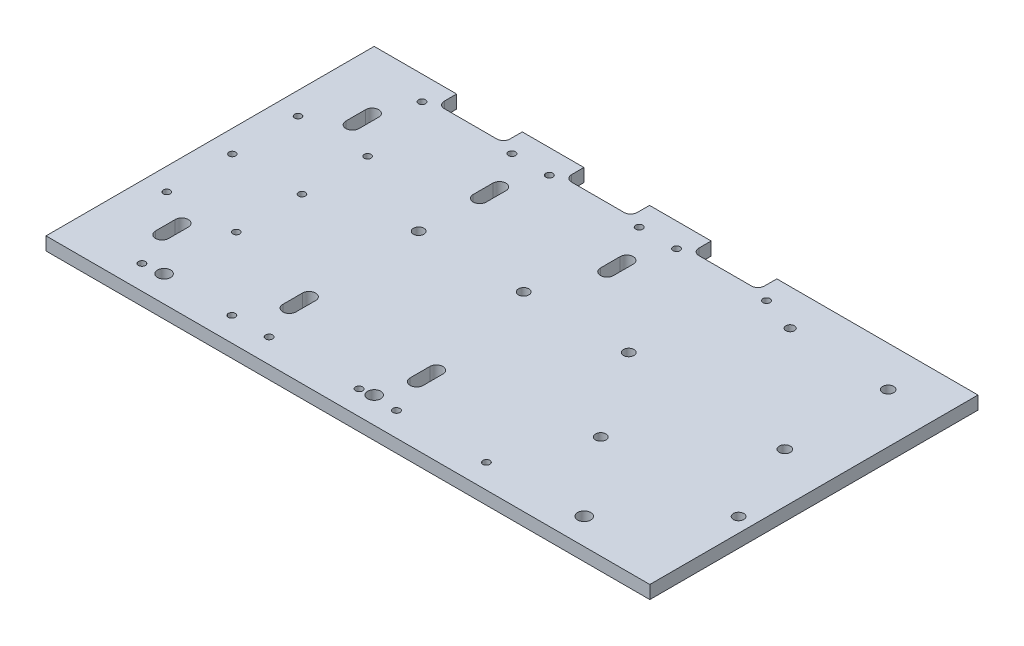
from build123d import *

# Parameters (mm, degrees)
SKETCH1_W           = 292.1
SKETCH1_H           = 158.75
BOSS_EXTRUDE1_DEPTH = 6.35
SKETCH2_R           = 3.175
CUT_EXTRUDE2_DEPTH  = 6.35
SKETCH4_R           = 2.54
SKETCH4_R_2         = 1.651
SKETCH4_R_3         = 2.667
SKETCH4_R_4         = 1.69999914
SKETCH4_R_5         = 2.0955
CUT_EXTRUDE5_DEPTH  = 333.512097524


with BuildPart() as part:
    # Sketch1 → Boss-Extrude1 (new body)
    with BuildSketch(Plane(origin=(0, 0, 0), x_dir=(1, 0, 0), z_dir=(0, 1, 0))):
        with Locations((146.05, 79.375)):
            Rectangle(SKETCH1_W, SKETCH1_H)
    extrude(amount=BOSS_EXTRUDE1_DEPTH)

    # Sketch2 → Cut-Extrude2 (cut)
    with BuildSketch(Plane(origin=(0, 6.35, 0), x_dir=(1, 0, 0), z_dir=(0, 1, 0))):
        with Locations(Location((146.05, 12.7, 0), (0, 0, 270))):
            Circle(SKETCH2_R)
        with Locations(Location((247.65, 12.7, 0), (0, 0, 270))):
            Circle(SKETCH2_R)
        with Locations(Location((44.45, 12.7, 0), (0, 0, 270))):
            Circle(SKETCH2_R)
    extrude(amount=-CUT_EXTRUDE2_DEPTH, mode=Mode.SUBTRACT)

    # Sketch4 → Cut-Extrude5 (cut, through all)
    with BuildSketch(Plane(origin=(0, 6.35, 0), x_dir=(1, 0, 0), z_dir=(0, 1, 0))):
        with Locations(Location((88.2015, 92.075, 0), (0, 0, 270))):
            Circle(SKETCH4_R)
        with Locations(Location((44.45, 111.125, 0), (0, 0, 270))):
            Circle(SKETCH4_R_2)
        with Locations(Location((44.45, 79.375, 0), (0, 0, 270))):
            Circle(SKETCH4_R_2)
        with Locations(Location((44.45, 47.625, 0), (0, 0, 270))):
            Circle(SKETCH4_R_2)
        with Locations(Location((10.795, 111.125, 0), (0, 0, 270))):
            Circle(SKETCH4_R_2)
        with Locations(Location((10.795, 79.375, 0), (0, 0, 270))):
            Circle(SKETCH4_R_2)
        with Locations(Location((10.795, 47.625, 0), (0, 0, 270))):
            Circle(SKETCH4_R_2)
        with Locations(Location((139.0015, 92.075, 0), (0, 0, 270))):
            Circle(SKETCH4_R)
        with Locations(Location((189.8015, 92.075, 0), (0, 0, 270))):
            Circle(SKETCH4_R)
        with Locations(Location((218.4146, 49.9364, 0), (0, 0, 270))):
            Circle(SKETCH4_R)
        with Locations(Location((285.0896, 49.9364, 0), (0, 0, 270))):
            Circle(SKETCH4_R)
        with Locations(Location((268.097, 139.3, 0), (0, 0, 270))):
            Circle(SKETCH4_R_3)
        with Locations(Location((268.097, 89.3, 0), (0, 0, 270))):
            Circle(SKETCH4_R_3)
        with Locations(Location((201.40419192, 147.125001204, 0), (0, 0, 270))):
            Circle(SKETCH4_R_4)
        with Locations(Location((157.90419256, 147.124999631, 0), (0, 0, 270))):
            Circle(SKETCH4_R_4)
        with Locations(Location((139.83529192, 147.125001204, 0), (0, 0, 270))):
            Circle(SKETCH4_R_4)
        with Locations(Location((96.33529256, 147.124999631, 0), (0, 0, 270))):
            Circle(SKETCH4_R_4)
        with Locations(Location((78.26639192, 147.125001204, 0), (0, 0, 270))):
            Circle(SKETCH4_R_4)
        with Locations(Location((34.76639256, 147.124999631, 0), (0, 0, 270))):
            Circle(SKETCH4_R_4)
        with Locations(Location((157.90419746, 11.624998851, 0), (0, 0, 270))):
            Circle(SKETCH4_R_4)
        with Locations(Location((201.40419682, 11.625000424, 0), (0, 0, 270))):
            Circle(SKETCH4_R_4)
        with Locations(Location((139.83529682, 11.625000424, 0), (0, 0, 270))):
            Circle(SKETCH4_R_4)
        with Locations(Location((96.33529746, 11.624998851, 0), (0, 0, 270))):
            Circle(SKETCH4_R_4)
        with Locations(Location((78.26639682, 11.625000424, 0), (0, 0, 270))):
            Circle(SKETCH4_R_4)
        with Locations(Location((34.76639746, 11.624998851, 0), (0, 0, 270))):
            Circle(SKETCH4_R_4)
        with Locations(Location((218.69969445, 141.2875, 0), (0, 0, 270))):
            Circle(SKETCH4_R_5)
        with BuildLine():
            Line((92.33531063, 130.175), (92.33531063, 120.65))
            ThreePointArc((92.33531063, 120.65), (89.16031063, 117.475), (85.98531063, 120.65))
            Line((85.98531063, 120.65), (85.98531063, 130.175))
            ThreePointArc((85.98531063, 130.175), (89.16031063, 133.35), (92.33531063, 130.175))
        make_face()
        with BuildLine():
            Line((30.76641063, 130.175), (30.76641063, 120.65))
            ThreePointArc((30.76641063, 120.65), (27.59141063, 117.475), (24.41641063, 120.65))
            Line((24.41641063, 120.65), (24.41641063, 130.175))
            ThreePointArc((24.41641063, 130.175), (27.59141063, 133.35), (30.76641063, 130.175))
        make_face()
        with BuildLine():
            Line((153.90421063, 130.175), (153.90421063, 120.65))
            ThreePointArc((153.90421063, 120.65), (150.72921063, 117.475), (147.55421063, 120.65))
            Line((147.55421063, 120.65), (147.55421063, 130.175))
            ThreePointArc((147.55421063, 130.175), (150.72921063, 133.35), (153.90421063, 130.175))
        make_face()
        with BuildLine():
            Line((153.90421063, 38.1), (153.90421063, 28.575))
            ThreePointArc((153.90421063, 28.575), (150.72921063, 25.4), (147.55421063, 28.575))
            Line((147.55421063, 28.575), (147.55421063, 38.1))
            ThreePointArc((147.55421063, 38.1), (150.72921063, 41.275), (153.90421063, 38.1))
        make_face()
        with BuildLine():
            Line((30.76641063, 38.1), (30.76641063, 28.575))
            ThreePointArc((30.76641063, 28.575), (27.59141063, 25.4), (24.41641063, 28.575))
            Line((24.41641063, 28.575), (24.41641063, 38.1))
            ThreePointArc((24.41641063, 38.1), (27.59141063, 41.275), (30.76641063, 38.1))
        make_face()
        with BuildLine():
            Line((92.33531063, 38.1), (92.33531063, 28.575))
            ThreePointArc((92.33531063, 28.575), (89.16031063, 25.4), (85.98531063, 28.575))
            Line((85.98531063, 28.575), (85.98531063, 38.1))
            ThreePointArc((85.98531063, 38.1), (89.16031063, 41.275), (92.33531063, 38.1))
        make_face()
        with BuildLine():
            Line((68.466400276, 149.625002844), (43.066400276, 149.625000636))
            ThreePointArc((43.066400276, 149.625000636), (40.821336067, 150.554938716), (39.8914, 152.800002844))
            Line((39.8914, 152.800002844), (39.8914, 158.75))
            Line((39.8914, 158.75), (71.6414, 158.75))
            Line((71.6414, 158.75), (71.6414, 152.800002844))
            ThreePointArc((71.6414, 152.800002844), (70.711464128, 150.554938912), (68.466400276, 149.625002844))
        make_face()
        with BuildLine():
            Line((101.4603, 152.800000636), (101.4603, 158.75))
            Line((101.4603, 158.75), (133.210297791, 158.75))
            Line((133.210297791, 158.75), (133.210297791, 152.800000636))
            ThreePointArc((133.210297791, 152.800000636), (132.280362566, 150.554938265), (130.035300276, 149.625002844))
            Line((130.035300276, 149.625002844), (104.635300276, 149.625000636))
            ThreePointArc((104.635300276, 149.625000636), (102.390236067, 150.554936508), (101.4603, 152.800000636))
        make_face()
        with BuildLine():
            Line((194.779197791, 158.75), (163.0292, 158.75))
            Line((163.0292, 158.75), (163.0292, 152.800000636))
            ThreePointArc((163.0292, 152.800000636), (163.959136067, 150.554936508), (166.204200276, 149.625000636))
            Line((166.204200276, 149.625000636), (191.604200276, 149.625002844))
            ThreePointArc((191.604200276, 149.625002844), (193.849262566, 150.554938265), (194.779197791, 152.800000636))
            Line((194.779197791, 152.800000636), (194.779197791, 158.75))
        make_face()
    extrude(amount=-CUT_EXTRUDE5_DEPTH, mode=Mode.SUBTRACT)


solid = part.part
